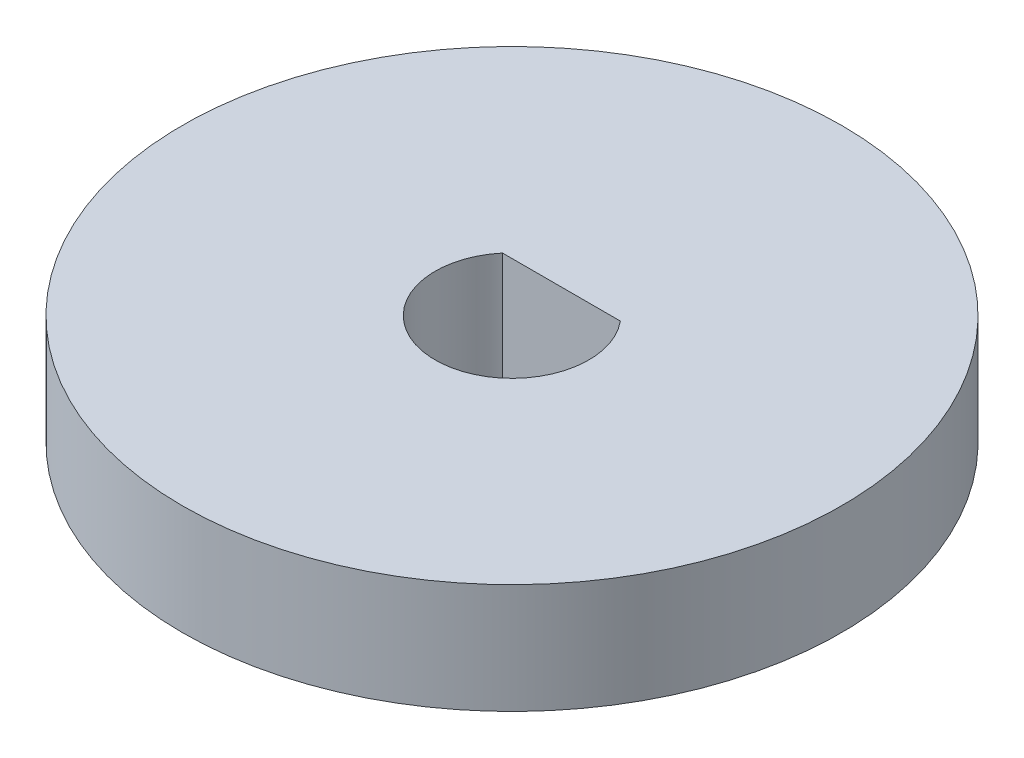
from build123d import *

# Parameters (mm, degrees)
SKETCH_1_R      = 6
EXTRUDE_1_DEPTH = 2


with BuildPart() as part:
    # Эскиз1 → Бобышка-Вытянуть1 (new body)
    with BuildSketch(Plane(origin=(0, 0, 0), x_dir=(1, 0, 0), z_dir=(0, 1, 0))):
        with Locations(Location((0, 0, 0), (0, 0, 270))):
            Circle(SKETCH_1_R)
        with BuildLine():
            Line((-1.072380529, 0.9), (1.072380529, 0.9))
            ThreePointArc((1.072380529, 0.9), (0, -1.4), (-1.072380529, 0.9))
        make_face(mode=Mode.SUBTRACT)
    extrude(amount=EXTRUDE_1_DEPTH)


solid = part.part
